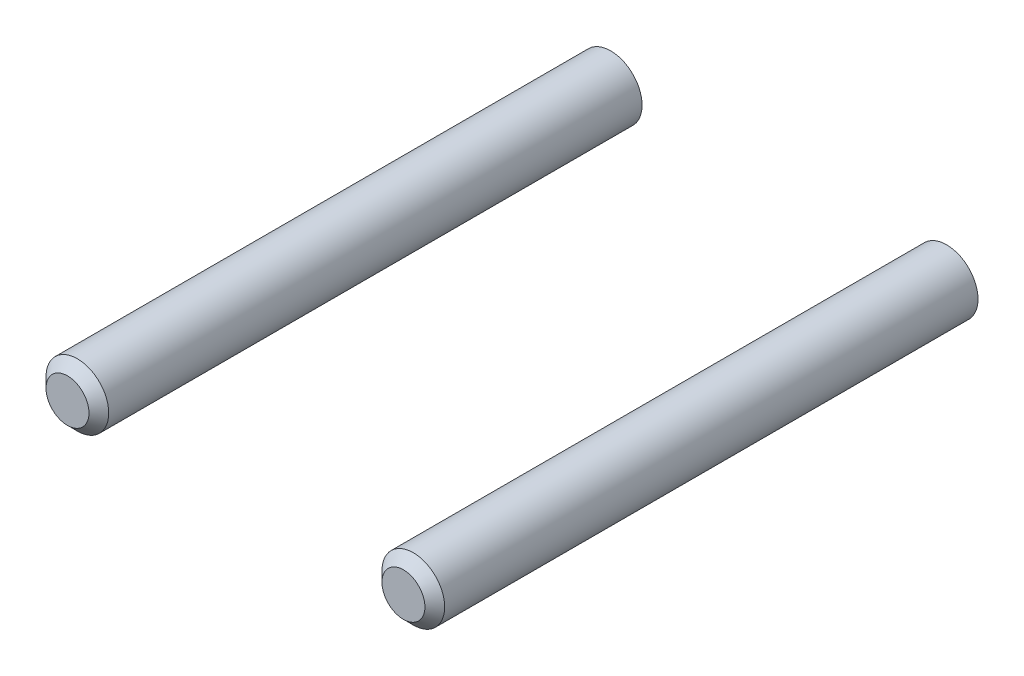
from build123d import *

# Parameters (mm, degrees)
BOSS_EXTRUDE1_DEPTH        = 20
BOSS_EXTRUDE1_DEPTH_BACK   = 90
SKETCH1_R                  = 6.35
BOSS_EXTRUDE1_2_DEPTH      = 20
BOSS_EXTRUDE1_2_DEPTH_BACK = 90
CHAMFER3_SIZE              = 2
CHAMFER4_SIZE              = 2


with BuildPart() as part:
    # Sketch1 → Boss-Extrude1 (new, two sides: drawn at the far end of the back side and taken through both)
    with BuildSketch(Plane.XY.offset(-BOSS_EXTRUDE1_DEPTH_BACK)):
        with Locations((-31.506467261, 36.903395316)):
            Circle(SKETCH1_R)
    extrude(amount=BOSS_EXTRUDE1_DEPTH + BOSS_EXTRUDE1_DEPTH_BACK)

    # Chamfer3
    chamfer3_edges = [part.edges().sort_by_distance(p)[0] for p in [
        (-37.856467261, 36.903395316, 20),
    ]]
    chamfer(chamfer3_edges, length=CHAMFER3_SIZE)


with BuildPart() as body_2:
    # Sketch1 → Boss-Extrude1 2 (new, two sides: drawn at the far end of the back side and taken through both)
    with BuildSketch(Plane.XY.offset(-BOSS_EXTRUDE1_2_DEPTH_BACK)):
        with Locations((36.522969991, 36.903395316)):
            Circle(SKETCH1_R)
    extrude(amount=BOSS_EXTRUDE1_2_DEPTH + BOSS_EXTRUDE1_2_DEPTH_BACK)

    # Chamfer4
    chamfer4_edges = [body_2.edges().sort_by_distance(p)[0] for p in [
        (30.172969991, 36.903395316, 20),
    ]]
    chamfer(chamfer4_edges, length=CHAMFER4_SIZE)


solid = Compound([part.part, body_2.part])
